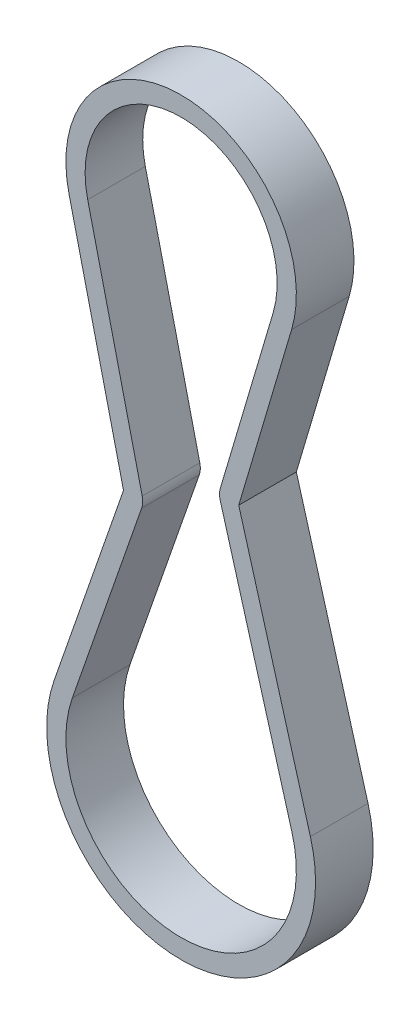
from build123d import *

# Parameters (mm, degrees)
EXTRUDE_1_DEPTH = 9


with BuildPart() as part:
    # 草图1 → 凸台-拉伸1 (new body)
    with BuildSketch(Plane.XY):
        with BuildLine():
            Line((9, -4.461217091), (20.194287223, -43.700074535))
            ThreePointArc((20.194287223, -43.700074535), (-0.601689007, -70.452595567), (-19.831131739, -42.552800924))
            Line((-19.831131739, -42.552800924), (-9, -11.461217091))
            Line((-9, -11.461217091), (-17.512781831, 24.379158821))
            ThreePointArc((-17.512781831, 24.379158821), (0.492386715, 46.532047075), (17.259086335, 23.427624637))
            Line((17.259086335, 23.427624637), (9, -4.461217091))
        make_face()
        with BuildLine():
            Line((-14.593984859, 25.072429503), (-6.081203028, -10.767946409))
            ThreePointArc((-6.081203028, -10.767946409), (-6.003901946, -11.614176084), (-6.16698118, -12.448133686))
            Line((-6.16698118, -12.448133686), (-16.998112919, -43.539717519))
            ThreePointArc((-16.998112919, -43.539717519), (-0.515733435, -67.453827213), (17.309389049, -44.5230949))
            Line((17.309389049, -44.5230949), (6.115101825, -5.284237456))
            ThreePointArc((6.115101825, -5.284237456), (6.000037583, -4.446200468), (6.123485611, -3.609357379))
            Line((6.123485611, -3.609357379), (14.382571946, 24.279484349))
            ThreePointArc((14.382571946, 24.279484349), (0.410322262, 43.533169714), (-14.593984859, 25.072429503))
        make_face(mode=Mode.SUBTRACT)
    extrude(amount=EXTRUDE_1_DEPTH)


solid = part.part
